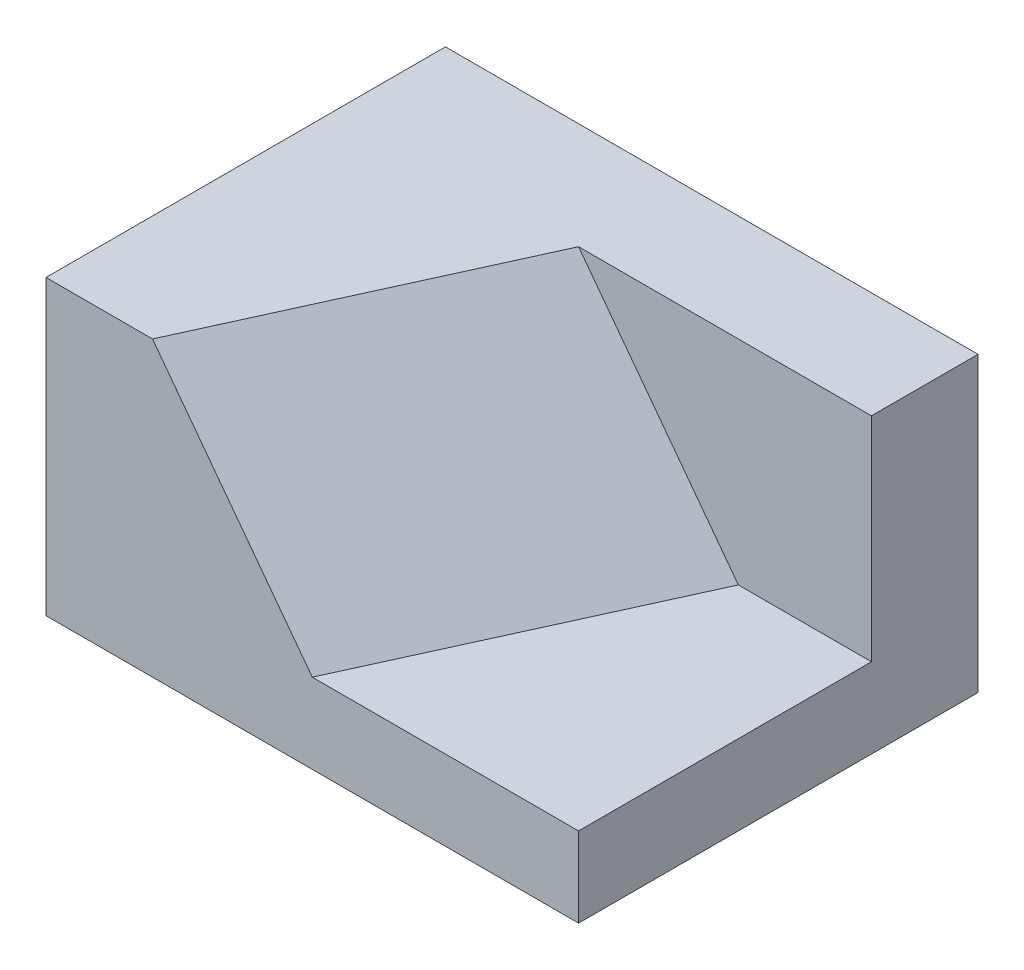
from build123d import *

# Parameters (mm, degrees)
BOSS_EXTRUDE1_DEPTH = 100
SKETCH1_3_W         = 55
SKETCH1_3_H         = 40
BOSS_EXTRUDE2_DEPTH = 75
CUT_EXTRUDE1_DEPTH  = 75


with BuildPart() as part:
    # Sketch1 → Boss-Extrude1 (new body)
    with BuildSketch(Plane(origin=(0, 0, 0), x_dir=(0, 0, -1), z_dir=(1, 0, 0))):
        Polygon((20, 40), (0, 40), (0, 0), (-55, 0), (-55, -15), (20, -15), align=None)
    extrude(amount=BOSS_EXTRUDE1_DEPTH)

    # Sketch1<3> → Boss-Extrude2 (add)
    with BuildSketch(Plane(origin=(0, 0, 0), x_dir=(0, 0, -1), z_dir=(1, 0, 0))):
        with Locations((-27.5, 20)):
            Rectangle(SKETCH1_3_W, SKETCH1_3_H)
    extrude(amount=BOSS_EXTRUDE2_DEPTH)

    # Sketch4 → Cut-Extrude1 (cut, along a direction that is not the sketch's normal)
    with BuildSketch(Plane(origin=(42.394160584, 31.795620438, 19.270072993), x_dir=(-0.27339445046936345, -0.20504583785202254, 0.9397934234884372), z_dir=(-0.7518347387907499, -0.5638760540930621, -0.34174306308670427))):
        Polygon((38.018915768, 20), (-20.504583785, 5), (-20.504583785, -45), (38.018915768, -30), align=None)
    extrude(amount=-CUT_EXTRUDE1_DEPTH, dir=(-1, 0, 0), mode=Mode.SUBTRACT)


solid = part.part
